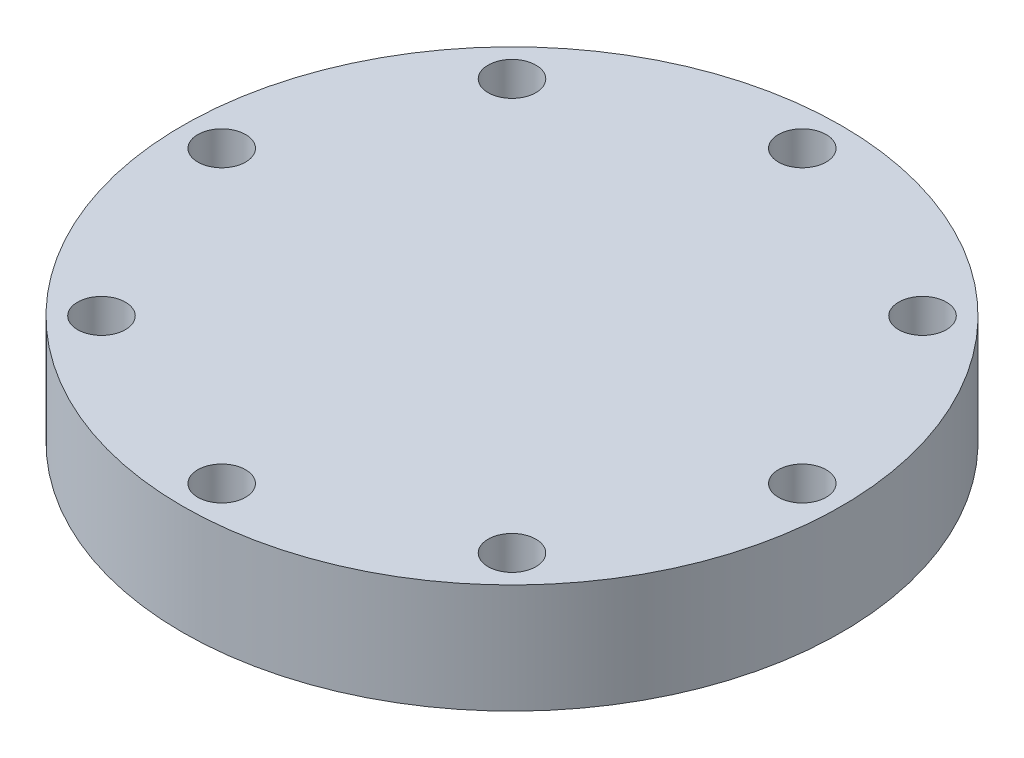
from build123d import *

# Parameters (mm, degrees)
SKETCH1_R           = 48.25
SKETCH1_R_2         = 36
BOSS_EXTRUDE6_DEPTH = 10
SKETCH21_R          = 2
CUT_EXTRUDE1_DEPTH  = 18
CIRPATTERN1_COUNT   = 8
SKETCH22_R          = 3.5
CUT_EXTRUDE2_DEPTH  = 4
CIRPATTERN2_COUNT   = 8
SKETCH23_R          = 48.25
BOSS_EXTRUDE7_DEPTH = 6
CUT_EXTRUDE3_START  = -6
SKETCH25_R          = 3.5
CUT_EXTRUDE3_DEPTH  = 6
CIRPATTERN4_COUNT   = 8


with BuildPart() as part:
    # Sketch1 → Boss-Extrude6 (new body)
    with BuildSketch(Plane(origin=(0, 0, 0), x_dir=(1, 0, 0), z_dir=(0, 1, 0))):
        with Locations(Location((0, 0, 0), (0, 0, 270))):
            Circle(SKETCH1_R)
        with Locations(Location((0, 0, 0), (0, 0, 270))):
            Circle(SKETCH1_R_2, mode=Mode.SUBTRACT)
    extrude(amount=BOSS_EXTRUDE6_DEPTH)

    # Sketch21 → Cut-Extrude1 (cut)
    with BuildSketch(Plane(origin=(0, 10, 0), x_dir=(1, 0, 0), z_dir=(0, 1, 0))):
        with Locations(Location((-42.5, 0, 0), (0, 0, 270))):
            Circle(SKETCH21_R)
    cut_extrude1 = extrude(amount=-CUT_EXTRUDE1_DEPTH, mode=Mode.SUBTRACT)

    # CirPattern1: Cut-Extrude1 ×8 about axis
    cirpattern1_axis = Axis((0, 0, 0), (0, 1, 0))
    for i in range(1, CIRPATTERN1_COUNT):
        add(cut_extrude1.rotate(cirpattern1_axis, i * 360 / CIRPATTERN1_COUNT), mode=Mode.SUBTRACT)

    # Sketch22 → Cut-Extrude2 (cut)
    with BuildSketch(Plane(origin=(0, 10, 0), x_dir=(1, 0, 0), z_dir=(0, 1, 0))):
        with Locations(Location((-42.5, 0, 0), (0, 0, 270))):
            Circle(SKETCH22_R)
    cut_extrude2 = extrude(amount=-CUT_EXTRUDE2_DEPTH, mode=Mode.SUBTRACT)

    # CirPattern2: Cut-Extrude2 ×8 about axis
    cirpattern2_axis = Axis((0, 0, 0), (0, 1, 0))
    for i in range(1, CIRPATTERN2_COUNT):
        add(cut_extrude2.rotate(cirpattern2_axis, i * 360 / CIRPATTERN2_COUNT), mode=Mode.SUBTRACT)

    # Sketch23 → Boss-Extrude7 (add)
    with BuildSketch(Plane(origin=(0, 10, 0), x_dir=(1, 0, 0), z_dir=(0, 1, 0))):
        with Locations(Location((0, 0, 0), (0, 0, 270))):
            Circle(SKETCH23_R)
    extrude(amount=BOSS_EXTRUDE7_DEPTH)

    # Sketch25 → Cut-Extrude3 (cut)
    with BuildSketch(Plane.XZ.offset(-10).offset(CUT_EXTRUDE3_START)):
        with Locations(Location((-42.5, 0, 0), (0, 0, 90))):
            Circle(SKETCH25_R)
    cut_extrude3 = extrude(amount=CUT_EXTRUDE3_DEPTH, mode=Mode.SUBTRACT)

    # CirPattern4: Cut-Extrude3 ×8 about axis
    cirpattern4_axis = Axis((0, 10, 0), (0, -1, 0))
    for i in range(1, CIRPATTERN4_COUNT):
        add(cut_extrude3.rotate(cirpattern4_axis, i * 360 / CIRPATTERN4_COUNT), mode=Mode.SUBTRACT)


solid = part.part
